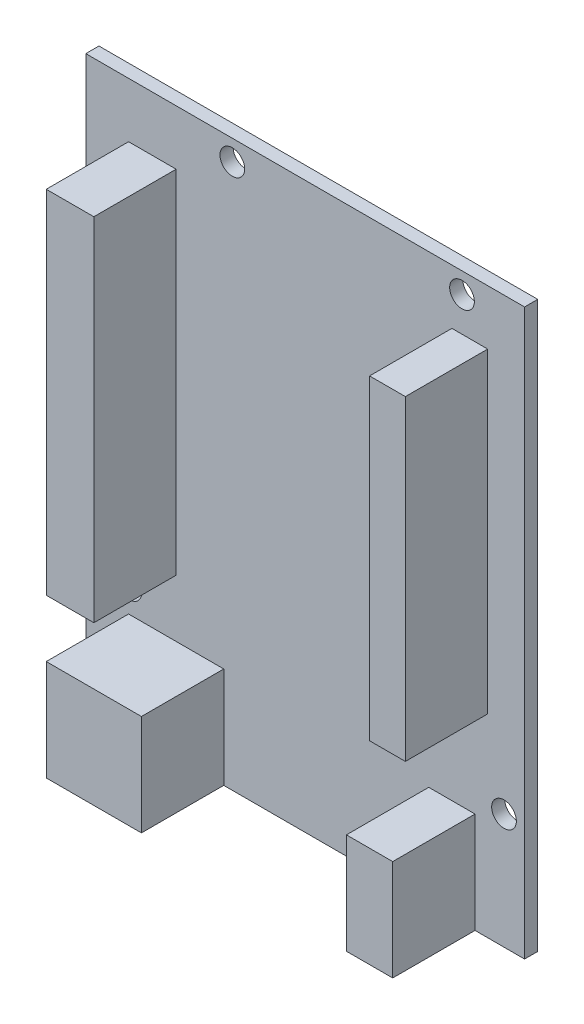
from build123d import *

# Parameters (mm, degrees)
SKETCH_1_W      = 53.3
SKETCH_1_H      = 68.6
SKETCH_1_R      = 1.5
EXTRUDE_1_DEPTH = 1.6
SKETCH_2_W      = 11.561255196
SKETCH_2_H      = 12.248286565
SKETCH_2_W_2    = 5.622199285
SKETCH_2_W_3    = 5.780627598
SKETCH_2_H_2    = 42.710987652
SKETCH_2_W_4    = 4.348124609
SKETCH_2_H_3    = 38.380226424
EXTRUDE_2_DEPTH = 10


with BuildPart() as part:
    # 草图1 → 凸台-拉伸1 (new body)
    with BuildSketch(Plane.XY):
        with Locations((-11.140811044, 19.148070952)):
            Rectangle(SKETCH_1_W, SKETCH_1_H)
        with Locations((-19.990811044, 50.948070952)):
            Circle(SKETCH_1_R, mode=Mode.SUBTRACT)
        with Locations((7.909188956, 50.948070952)):
            Circle(SKETCH_1_R, mode=Mode.SUBTRACT)
        with Locations((-32.490811044, 0.148070952)):
            Circle(SKETCH_1_R, mode=Mode.SUBTRACT)
        with Locations((13.009188956, -1.151929048)):
            Circle(SKETCH_1_R, mode=Mode.SUBTRACT)
    extrude(amount=EXTRUDE_1_DEPTH)

    # 草图2 → 凸台-拉伸2 (add)
    with BuildSketch(Plane.XY.offset(1.6)):
        with Locations((-26.811580019, -9.027785766)):
            Rectangle(SKETCH_2_W, SKETCH_2_H)
        with Locations((6.68110059, -9.027785766)):
            Rectangle(SKETCH_2_W_2, SKETCH_2_H)
        with Locations((-29.701893818, 25.423145352)):
            Rectangle(SKETCH_2_W_3, SKETCH_2_H_2)
        with Locations((8.855162896, 27.588525966)):
            Rectangle(SKETCH_2_W_4, SKETCH_2_H_3)
    extrude(amount=EXTRUDE_2_DEPTH)


solid = part.part
